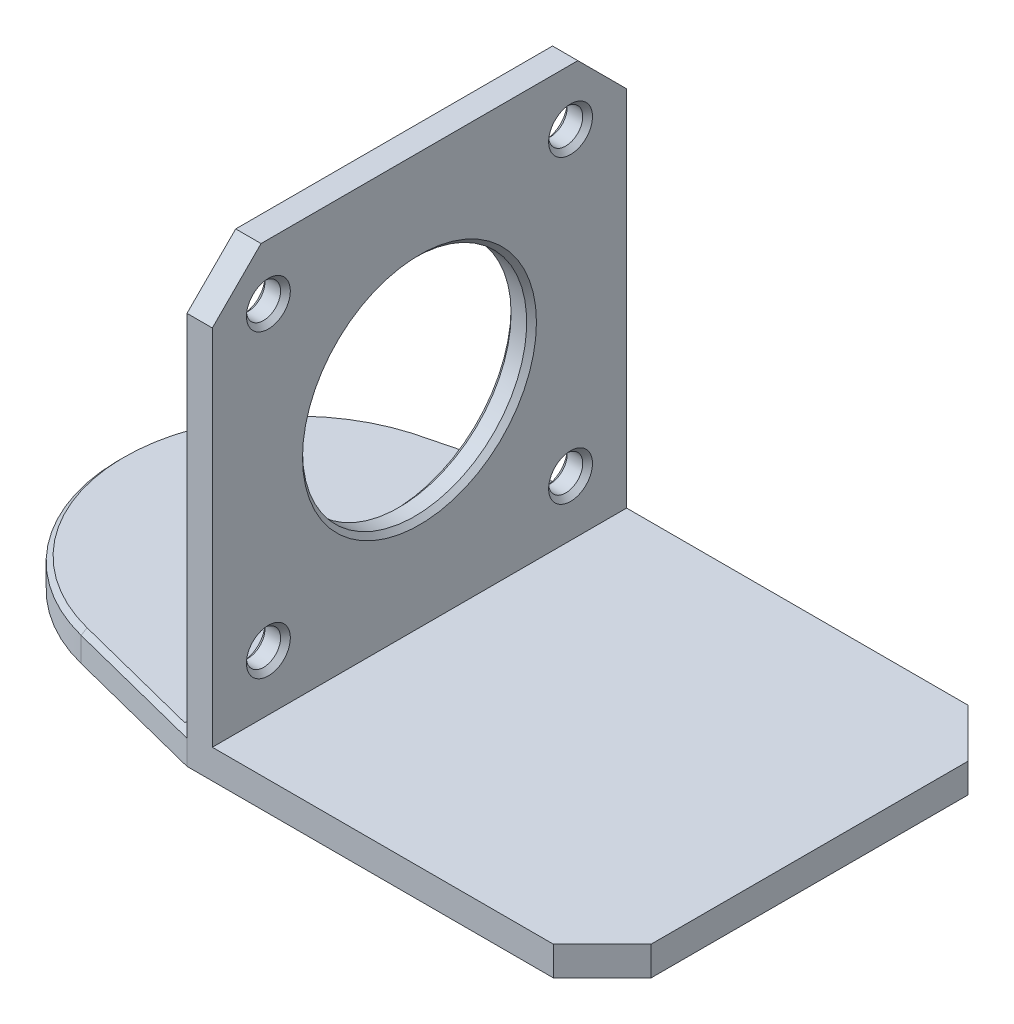
from build123d import *

# Parameters (mm, degrees)
SKETCH_1_R          = 3.625
EXTRUDE_1_DEPTH     = 16
EXTRUDE_3_DEPTH     = 3
SKETCH_3_W          = 2.6
SKETCH_3_H          = 42.5
EXTRUDE_4_DEPTH     = 42.25
SKETCH_4_R          = 11.5
SKETCH_4_R_2        = 1.75
CUT_EXTRUDE_1_DEPTH = 42.25
EXTRUDE_5_REACH     = 85.549
SKETCH_5_R          = 3.915
SKETCH_5_R_2        = 3.625
CUT_EXTRUDE_2_REACH = 85.549
CHAMFER_1_SIZE      = 0.5
CHAMFER_2_SIZE      = 1
CHAMFER_3_SIZE      = 5
SKETCH_7_W          = 19.912738871
SKETCH_7_H          = 22.903585025
CUT_EXTRUDE_3_DEPTH = 2
CHAMFER_4_SIZE      = 0.5


with BuildPart() as part:
    # 草图1 → 凸台-拉伸1 (new body)
    with BuildSketch(Plane(origin=(0, 0, 0), x_dir=(1, 0, 0), z_dir=(0, 1, 0))):
        Circle(SKETCH_1_R)
    extrude(amount=EXTRUDE_1_DEPTH)

    # 草图2 → 凸台-拉伸3 (add)
    with BuildSketch(Plane(origin=(0, 16, 0), x_dir=(1, 0, 0), z_dir=(0, 1, 0))):
        with BuildLine():
            Line((10.1, 21.25), (-5.119556865, 17.360879514))
            ThreePointArc((-5.119556865, 17.360879514), (-18.096837592, -0.3383329), (-4.467058756, -17.540107926))
            Line((-4.467058756, -17.540107926), (10.1, -21.25))
            Line((10.1, -21.25), (52.7, -21.25))
            Line((52.7, -21.25), (52.7, 21.25))
            Line((52.7, 21.25), (10.1, 21.25))
        make_face()
    extrude(amount=EXTRUDE_3_DEPTH)

    # 草图3 → 凸台-拉伸4 (add)
    with BuildSketch(Plane(origin=(0, 19, 0), x_dir=(1, 0, 0), z_dir=(0, 1, 0))):
        with Locations((11.4, 0)):
            Rectangle(SKETCH_3_W, SKETCH_3_H)
    extrude(amount=EXTRUDE_4_DEPTH)

    # 草图4 → 切除-拉伸1 (cut)
    with BuildSketch(Plane.ZY.offset(-10.1)):
        with Locations((0, 40.125)):
            Circle(SKETCH_4_R)
        with Locations((-15.5, 55.533823529)):
            Circle(SKETCH_4_R_2)
        with Locations((15.5, 55.533823529)):
            Circle(SKETCH_4_R_2)
        with Locations((15.5, 24.716176471)):
            Circle(SKETCH_4_R_2)
        with Locations((-15.5, 24.716176471)):
            Circle(SKETCH_4_R_2)
    extrude(amount=-CUT_EXTRUDE_1_DEPTH, mode=Mode.SUBTRACT)

    # 草图5 → 凸台-拉伸5 (add, up to next)
    with BuildSketch(Plane.XZ, mode=Mode.PRIVATE) as extrude_5_sk1:
        Circle(SKETCH_5_R)
        Circle(SKETCH_5_R_2, mode=Mode.SUBTRACT)
    extrude_5_tool1 = extrude(extrude_5_sk1.sketch, amount=-EXTRUDE_5_REACH, mode=Mode.PRIVATE) - part.part
    add(extrude_5_tool1.solids().sort_by_distance((-3.804267, 0, 0))[0])

    # 草图6 → 切除-拉伸2 (cut, up to next)
    with BuildSketch(Plane.XZ, mode=Mode.PRIVATE) as cut_extrude_2_sk1:
        with BuildLine():
            Line((-1.516575089, -2.05), (1.516575089, -2.05))
            ThreePointArc((1.516575089, -2.05), (0, 2.55), (-1.516575089, -2.05))
        make_face()
    cut_extrude_2_tool1 = extrude(cut_extrude_2_sk1.sketch, amount=-CUT_EXTRUDE_2_REACH, mode=Mode.PRIVATE) & part.part
    add(cut_extrude_2_tool1.solids().sort_by_distance((0, 0, 0.119895))[0], mode=Mode.SUBTRACT)

    # 倒角1
    chamfer_1_edges = [part.edges().sort_by_distance(p)[0] for p in [
        (12.7, 24.716176471, 13.75),
        (10.1, 24.716176471, 13.75),
        (12.7, 55.533823529, 13.75),
        (10.1, 55.533823529, 13.75),
        (12.7, 55.533823529, -17.25),
        (10.1, 55.533823529, -17.25),
        (12.7, 40.125, -11.5),
        (10.1, 40.125, -11.5),
        (12.7, 24.716176471, -17.25),
        (10.1, 24.716176471, -17.25),
        (-3.915, 0, 0),
        (0, 0, -2.05),
        (0, 0, 2.55),
        (0, 19, 2.55),
        (0, 19, -2.05),
        (2.816470622, 19, 19.395053963),
        (-18.096837592, 19, 0.3383329),
        (2.490221568, 19, -19.305439757),
    ]]
    chamfer(chamfer_1_edges, length=CHAMFER_1_SIZE)

    # 倒角2
    chamfer_2_edges = [part.edges().sort_by_distance(p)[0] for p in [
        (10.1, 19, 5.2997e-05),
    ]]
    chamfer(chamfer_2_edges, length=CHAMFER_2_SIZE)

    # 倒角3
    chamfer_3_edges = [part.edges().sort_by_distance(p)[0] for p in [
        (11.4, 61.25, 21.25),
        (11.4, 61.25, -21.25),
        (52.7, 17.5, 21.25),
        (52.7, 17.5, -21.25),
    ]]
    chamfer(chamfer_3_edges, length=CHAMFER_3_SIZE)

    # 草图7 → 切除-拉伸3 (cut)
    with BuildSketch(Plane.XZ):
        with Locations((2.581888661, -2.951492916)):
            Rectangle(SKETCH_7_W, SKETCH_7_H)
    extrude(amount=-CUT_EXTRUDE_3_DEPTH, mode=Mode.SUBTRACT)

    # 倒角4
    chamfer_4_edges = [part.edges().sort_by_distance(p)[0] for p in [
        (0, 2, 2.55),
        (0, 2, -2.05),
        (-3.915, 2, 0),
    ]]
    chamfer(chamfer_4_edges, length=CHAMFER_4_SIZE)


solid = part.part
